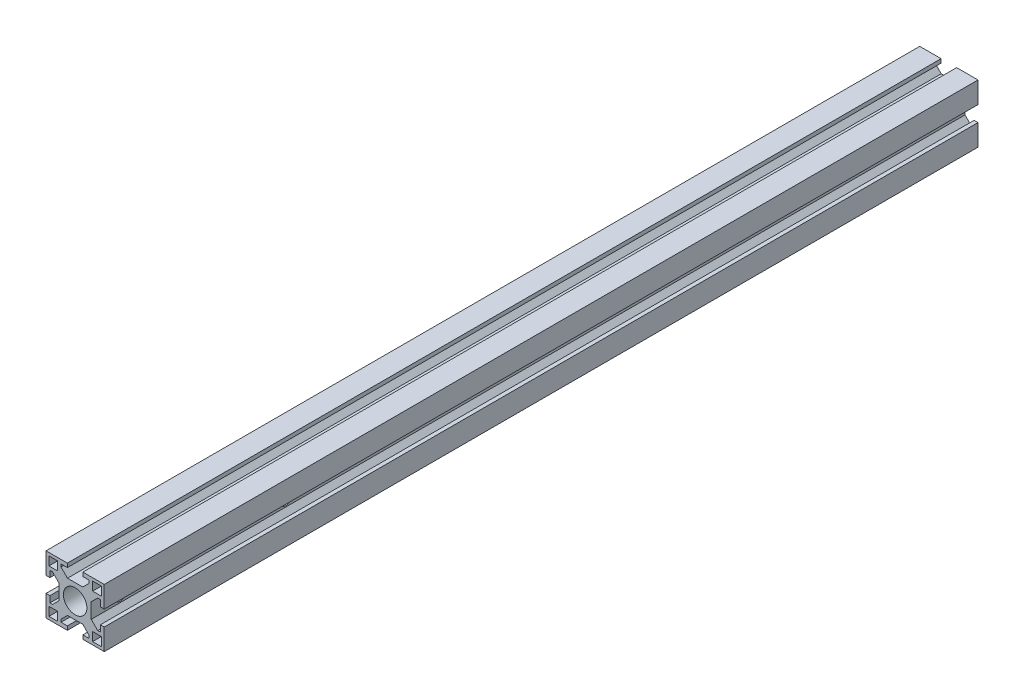
from build123d import *

# Parameters (mm, degrees)
SKIZZE1_R                       = 6.05
SKIZZE1_W                       = 4.5
SKIZZE1_H                       = 4.5
AUFSATZ_LINEAR_AUSTRAGEN1_DEPTH = 450
SKIZZE3_R                       = 3.3
SCHNITT_LINEAR_AUSTRAGEN2_DEPTH = 452.248268785


with BuildPart() as part:
    # Skizze1 → Aufsatz-Linear austragen1 (new body)
    with BuildSketch(Plane(origin=(0, 0, 0), x_dir=(-1, 0, 0), z_dir=(0, 0, -1))):
        Polygon((15.000004175, -14.999997298), (15.000004175, -3.999997298), (13.000004175, -3.999997298), (13.000004175, -7.265682298), (11.634319175, -7.265682298), (8.300003831, -3.931367382), (8.300003831, 3.931374091), (11.634315, 7.265685), (13.000004175, 7.265685), (13.000004175, 4.000002702), (15.000004175, 4.000002702), (15.000004175, 15.000002702), (4.000004175, 15.000002702), (4.000004175, 13.000002962), (7.265688438, 13.000002962), (7.265688438, 11.634318438), (3.931373306, 8.300003046), (-3.931368167, 8.300003046), (-7.265683511, 11.634317962), (-7.265683511, 13.000002962), (-3.999995825, 13.000002962), (-3.999995825, 15.000002702), (-14.999995825, 15.000002702), (-14.999995825, 4.000002702), (-12.999995825, 4.000002702), (-12.999995825, 7.265685), (-11.634315, 7.265685), (-8.3, 3.931371213), (-8.3, -3.931371213), (-11.634310825, -7.265682298), (-12.999995825, -7.265682298), (-12.999995825, -3.999997298), (-14.999995825, -3.999997298), (-14.999995825, -14.999997298), (-3.999995825, -14.999997298), (-3.999995825, -12.999997038), (-7.265683511, -12.999997038), (-7.265683511, -11.634312038), (-3.931368988, -8.299997775), (3.931373438, -8.299997775), (7.265688438, -11.634311562), (7.265688438, -12.999997038), (4.000004175, -12.999997038), (4.000004175, -14.999997298), align=None)
        with Locations(Location((0, 0, 0), (0, 0, 180))):
            Circle(SKIZZE1_R, mode=Mode.SUBTRACT)
        with Locations((11.25, 11.25)):
            Rectangle(SKIZZE1_W, SKIZZE1_H, mode=Mode.SUBTRACT)
        with Locations((11.25, -11.25)):
            Rectangle(SKIZZE1_W, SKIZZE1_H, mode=Mode.SUBTRACT)
        with Locations((-11.25, -11.25)):
            Rectangle(SKIZZE1_W, SKIZZE1_H, mode=Mode.SUBTRACT)
        with Locations((-11.25, 11.25)):
            Rectangle(SKIZZE1_W, SKIZZE1_H, mode=Mode.SUBTRACT)
    extrude(amount=-AUFSATZ_LINEAR_AUSTRAGEN1_DEPTH)

    # Skizze3 → Schnitt-Linear austragen2 (cut, through all)
    with BuildSketch(Plane.ZY.offset(15.000004175)):
        with Locations(Location((435, 0, 0), (0, 0, 180))):
            Circle(SKIZZE3_R)
        with Locations(Location((350, 0, 0), (0, 0, 180))):
            Circle(SKIZZE3_R)
    extrude(amount=-SCHNITT_LINEAR_AUSTRAGEN2_DEPTH, mode=Mode.SUBTRACT)


solid = part.part
